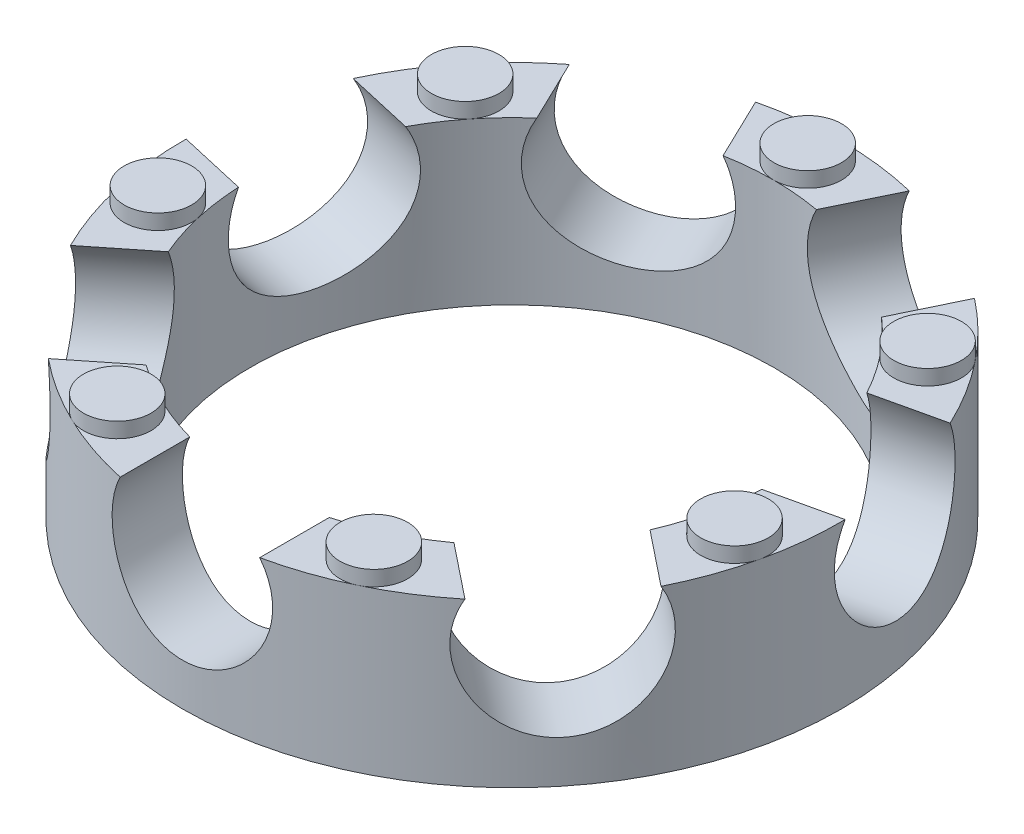
from build123d import *

# Parameters (mm, degrees)
SKETCH1_R               = 4.953
BOSS_EXTRUDE1_DEPTH     = 2.4384
SKETCH2_R               = 3.937
CUT_EXTRUDE1_DEPTH      = 2.4384
SKETCH3_R               = 0.508
BOSS_EXTRUDE2_DEPTH     = 2.667
CUT_EXTRUDE2_REACH      = 9.495
CUT_EXTRUDE2_END_RADIUS = 4.953
SKETCH4_R               = 1.2065
CIRPATTERN1_COUNT       = 7


with BuildPart() as part:
    # Sketch1 → Boss-Extrude1 (new body)
    with BuildSketch(Plane(origin=(0, 0, 0), x_dir=(1, 0, 0), z_dir=(0, 1, 0))):
        with Locations(Location((0, 0, 0), (0, 0, 270))):
            Circle(SKETCH1_R)
    extrude(amount=BOSS_EXTRUDE1_DEPTH)

    # Sketch2 → Cut-Extrude1 (cut)
    with BuildSketch(Plane(origin=(0, 2.4384, 0), x_dir=(1, 0, 0), z_dir=(0, 1, 0))):
        with Locations(Location((0, 0, 0), (0, 0, 270))):
            Circle(SKETCH2_R)
    extrude(amount=-CUT_EXTRUDE1_DEPTH, mode=Mode.SUBTRACT)

    # Sketch3 → Boss-Extrude2 (add)
    with BuildSketch(Plane(origin=(0, 0, 0), x_dir=(1, 0, 0), z_dir=(0, 1, 0))):
        with Locations(Location((0, 4.445, 0), (0, 0, 270))):
            Circle(SKETCH3_R)
        with Locations(Location((3.47524094, 2.771412169, 0), (0, 0, 38.571428571))):
            Circle(SKETCH3_R)
        with Locations(Location((4.33355457, -0.989105551, 0), (0, 0, 167.142857143))):
            Circle(SKETCH3_R)
        with Locations(Location((1.92861322, -4.004806618, 0), (0, 0, 115.714285714))):
            Circle(SKETCH3_R)
        with Locations(Location((-1.92861322, -4.004806618, 0), (0, 0, 64.285714286))):
            Circle(SKETCH3_R)
        with Locations(Location((-4.33355457, -0.989105551, 0), (0, 0, 12.857142857))):
            Circle(SKETCH3_R)
        with Locations(Location((-3.47524094, 2.771412169, 0), (0, 0, 141.428571429))):
            Circle(SKETCH3_R)
    extrude(amount=BOSS_EXTRUDE2_DEPTH)

    # Cut-Extrude2: up to this cylinder (the profile starts inside it)
    cut_extrude2_end = Plane(origin=(0, 1.8415, 0), z_dir=(0, -1, 0)) * Cylinder(CUT_EXTRUDE2_END_RADIUS, 29.896, mode=Mode.PRIVATE)
    # Sketch4 → Cut-Extrude2 (cut, up to the surface)
    with BuildSketch(Plane.XY, mode=Mode.PRIVATE) as cut_extrude2_sk1:
        with Locations((0, 1.8415)):
            Circle(SKETCH4_R)
    cut_extrude2_tool1 = extrude(cut_extrude2_sk1.sketch, amount=CUT_EXTRUDE2_REACH, mode=Mode.PRIVATE) & cut_extrude2_end
    cut_extrude2 = cut_extrude2_tool1.solids().sort_by_distance((0, 1.8415, 0))[0]
    add(cut_extrude2, mode=Mode.SUBTRACT)

    # CirPattern1: Cut-Extrude2 ×7 about axis
    cirpattern1_axis = Axis((0, 0, 0), (0, -1, 0))
    for i in range(1, CIRPATTERN1_COUNT):
        add(cut_extrude2.rotate(cirpattern1_axis, i * 360 / CIRPATTERN1_COUNT), mode=Mode.SUBTRACT)


solid = part.part
